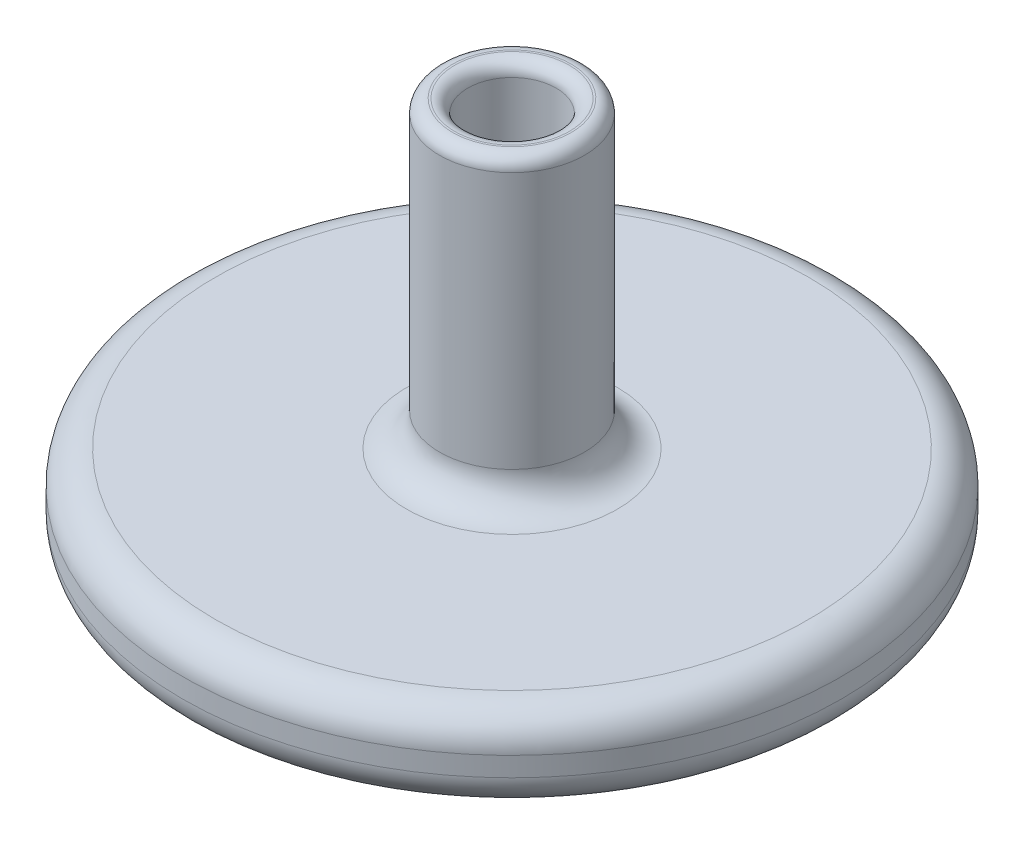
from build123d import *

# Parameters (mm, degrees)
FILLET1_R = 0.635
FILLET2_R = 0.254


with BuildPart() as part:
    # Sketch1 → Revolve1 (revolve)
    with BuildSketch(Plane.XY, mode=Mode.PRIVATE) as revolve1_sk:
        with BuildLine():
            Line((-0.8509, 8.0518), (-0.8509, 2.2098))
            Line((-0.8509, 2.2098), (0, 2.2098))
            Line((0, 2.2098), (0, 0))
            ThreePointArc((0, 0), (-3.193462918, 0.171947054), (-6.35, 0.6858))
            Line((-6.35, 0.6858), (-6.35, 2.2098))
            Line((-6.35, 2.2098), (-1.397, 2.2098))
            Line((-1.397, 2.2098), (-1.397, 8.0518))
            Line((-1.397, 8.0518), (-0.8509, 8.0518))
        make_face()
    revolve(revolve1_sk.sketch.rotate(Axis((0, 0, 0), (0, 1, 0)), 270), axis=Axis((0, 0, 0), (0, 1, 0)))

    # Fillet1
    fillet1_edges = [part.edges().sort_by_distance(p)[0] for p in [
        (0, 2.2098, 1.397),
        (0, 2.2098, 6.35),
        (0, 0.6858, 6.35),
    ]]
    fillet(fillet1_edges, radius=FILLET1_R)

    # Fillet2
    fillet2_edges = [part.edges().sort_by_distance(p)[0] for p in [
        (0, 8.0518, 1.397),
        (0, 8.0518, 0.8509),
    ]]
    fillet(fillet2_edges, radius=FILLET2_R)


solid = part.part
